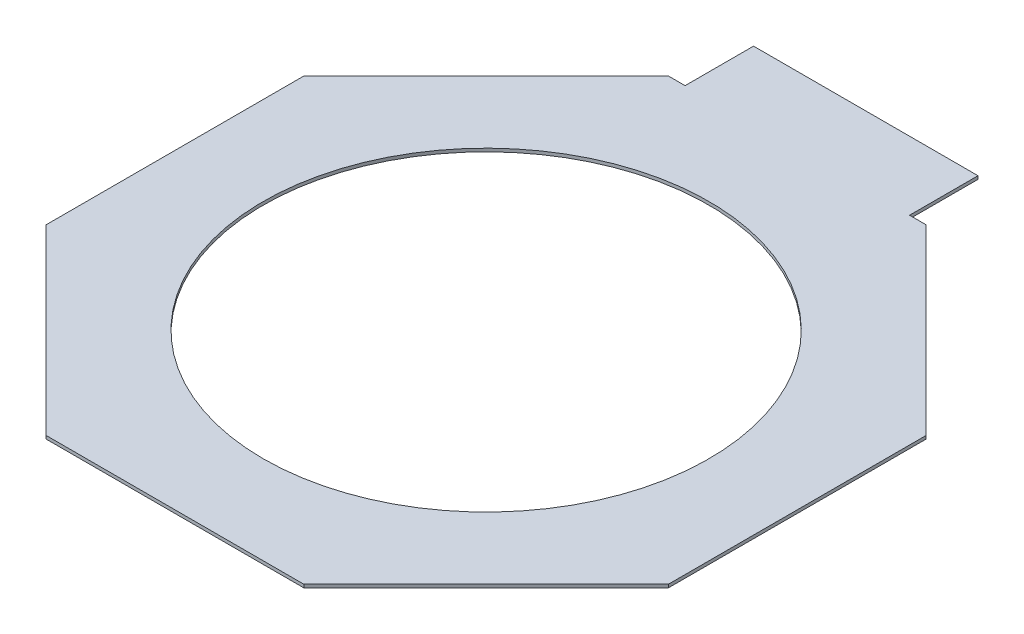
from build123d import *

# Parameters (mm, degrees)
ESBO_O1_R                = 14
RESSALTO_EXTRUS_O1_DEPTH = 0.1


with BuildPart() as part:
    # Esboço1 → Ressalto-extrusão1 (new, symmetric)
    with BuildSketch(Plane(origin=(0, 0, 0), x_dir=(1, 0, 0), z_dir=(0, 1, 0))):
        Polygon((-7.05, 19.55), (-8.097875144, 19.55), (-19.55, 8.097875144), (-19.55, -8.097875144), (-8.097875144, -19.55), (8.097875144, -19.55), (19.55, -8.097875144), (19.55, 8.097875144), (8.097875144, 19.55), (7.05, 19.55), (7.05, 23.85), (-7.05, 23.85), align=None)
        with Locations(Location((0, 0, 0), (0, 0, 270))):
            Circle(ESBO_O1_R, mode=Mode.SUBTRACT)
    extrude(amount=RESSALTO_EXTRUS_O1_DEPTH, both=True)


solid = part.part
